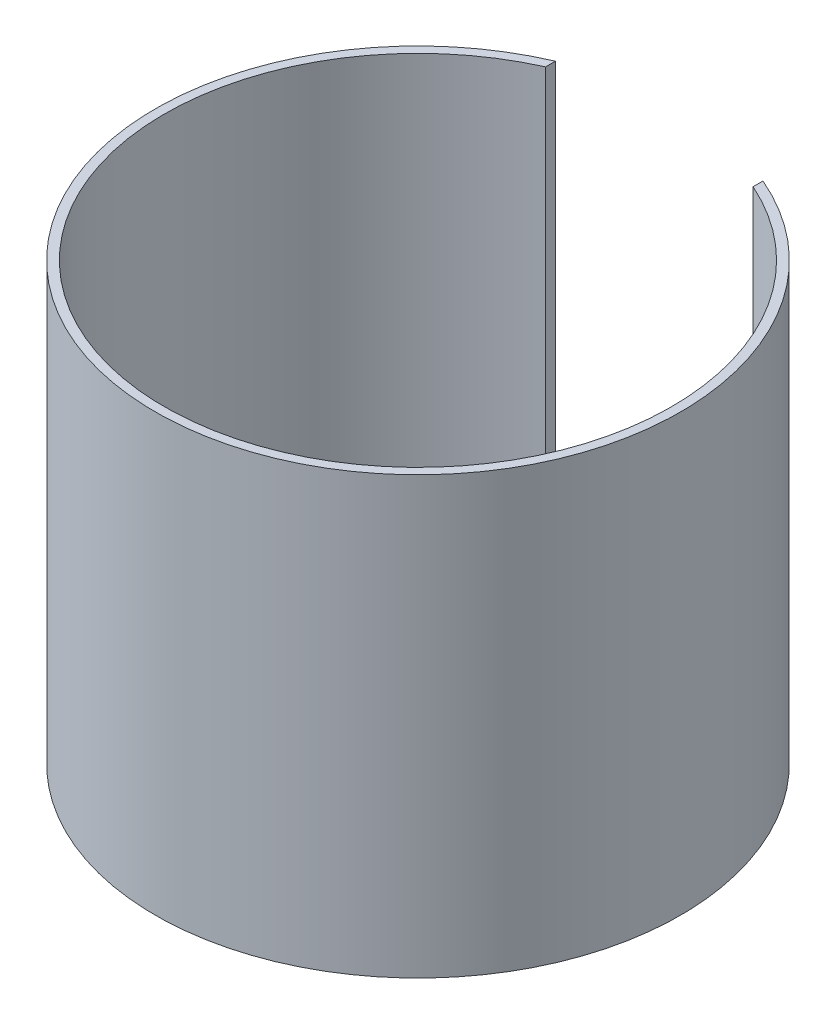
from build123d import *

# Parameters (mm, degrees)
SKETCH1_R           = 29.522
SKETCH1_R_2         = 28.506
BOSS_EXTRUDE1_DEPTH = 49
CUT_EXTRUDE1_DEPTH  = 47


with BuildPart() as part:
    # Sketch1 → Boss-Extrude1 (new body)
    with BuildSketch(Plane(origin=(0, 0, 0), x_dir=(1, 0, 0), z_dir=(0, 1, 0))):
        with Locations(Location((-43.29529893, 2.032281285, 0), (0, 0, 270))):
            Circle(SKETCH1_R)
        with Locations(Location((-43.29529893, 2.032281285, 0), (0, 0, 270))):
            Circle(SKETCH1_R_2, mode=Mode.SUBTRACT)
    extrude(amount=BOSS_EXTRUDE1_DEPTH)

    # Sketch2 → Cut-Extrude1 (cut)
    with BuildSketch(Plane.XY):
        Polygon((-54.96129893, 19.5), (-54.96129893, 49), (-31.62929893, 49), (-31.62929893, 19.5), (-31.62929893, 0), (-54.96129893, 0), align=None)
    extrude(amount=-CUT_EXTRUDE1_DEPTH, mode=Mode.SUBTRACT)


solid = part.part
